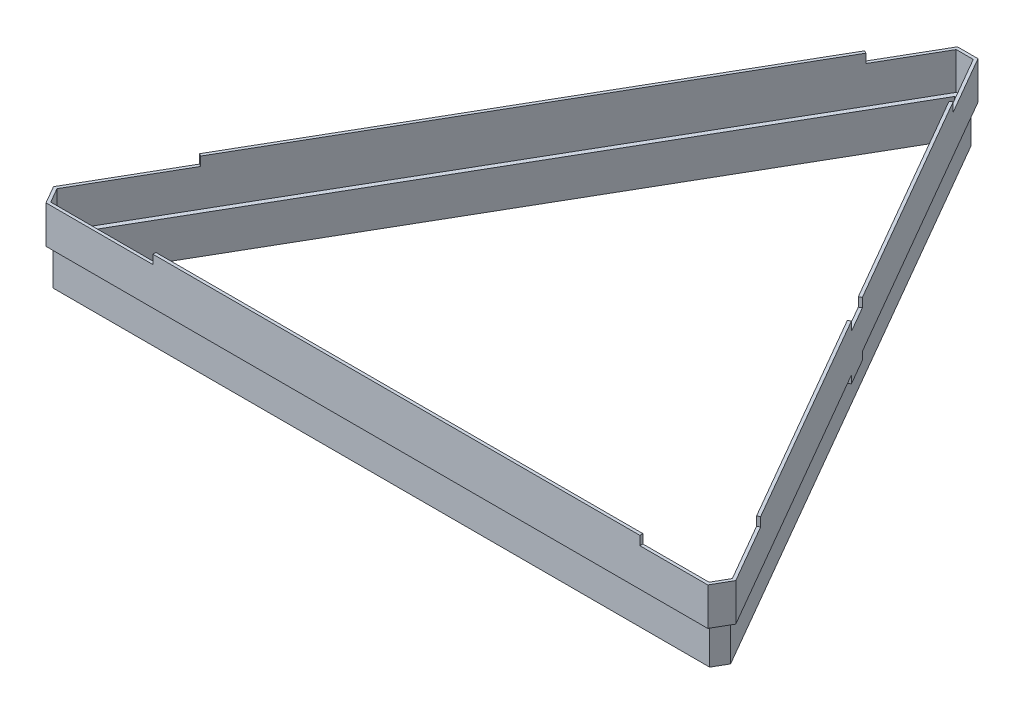
from build123d import *

# Parameters (mm, degrees)
BOSS_EXTRUDE1_DEPTH = 0.2
BOSS_EXTRUDE2_DEPTH = 12.58
SKETCH1_8_W         = 162.49
SKETCH1_8_H         = 1
BOSS_EXTRUDE3_DEPTH = 15.58
BOSS_EXTRUDE4_DEPTH = 12.38
BOSS_EXTRUDE5_DEPTH = 2.58


with BuildPart() as part:
    # Sketch1 → Boss-Extrude1 (new body)
    with BuildSketch(Plane(origin=(0, 0, 0), x_dir=(1, 0, 0), z_dir=(0, 1, 0))):
        Polygon((-113.845299462, 0), (-110.422649731, -5.92820323), (110.422649731, -5.92820323), (113.845299462, 0), (3.422649731, 191.25763964), (-3.422649731, 191.25763964), align=None)
        Polygon((108.979274058, -3.42820323), (-108.979274058, -3.42820323), (-110.958548116, 0), (-1.979274058, 188.75763964), (1.979274058, 188.75763964), (110.958548116, 0), align=None, mode=Mode.SUBTRACT)
    extrude(amount=BOSS_EXTRUDE1_DEPTH)

    # Sketch1<7> → Boss-Extrude2 (add)
    with BuildSketch(Plane(origin=(0, 0, 0), x_dir=(1, 0, 0), z_dir=(0, 1, 0))):
        Polygon((-95.137949192, 30.402081141), (-96.003974596, 30.902081141), (-113.845299462, 0), (-110.422649731, -5.92820323), (-74.74, -5.92820323), (-74.74, -4.92820323), (-109.845299462, -4.92820323), (-112.690598923, 0), align=None)
        Polygon((-3.422649731, 191.25763964), (-14.758974596, 171.622549002), (-13.892949192, 171.122549002), (-2.845299462, 190.25763964), (2.845299462, 190.25763964), (13.892949192, 171.122549002), (14.758974596, 171.622549002), (3.422649731, 191.25763964), align=None)
        Polygon((109.845299462, -4.92820323), (87.75, -4.92820323), (87.75, -5.92820323), (110.422649731, -5.92820323), (113.845299462, 0), (102.508974596, 19.635090638), (101.642949192, 19.135090638), (112.690598923, 0), align=None)
        Polygon((61.133974596, 91.298692801), (56.133974596, 99.958946839), (55.267949192, 99.458946839), (60.267949192, 90.798692801), align=None)
    extrude(amount=BOSS_EXTRUDE2_DEPTH)

    # Sketch1<8> → Boss-Extrude3 (add)
    with BuildSketch(Plane(origin=(0, 0, 0), x_dir=(1, 0, 0), z_dir=(0, 1, 0))):
        Polygon((-14.758974596, 171.622549002), (-96.003974596, 30.902081141), (-95.137949192, 30.402081141), (-13.892949192, 171.122549002), align=None)
        with Locations((6.505, -5.42820323)):
            Rectangle(SKETCH1_8_W, SKETCH1_8_H)
        Polygon((56.133974596, 99.958946839), (14.758974596, 171.622549002), (13.892949192, 171.122549002), (55.267949192, 99.458946839), align=None)
        Polygon((102.508974596, 19.635090638), (61.133974596, 91.298692801), (60.267949192, 90.798692801), (101.642949192, 19.135090638), align=None)
    extrude(amount=BOSS_EXTRUDE3_DEPTH)

    # Sketch1<9> → Boss-Extrude4 (add)
    with BuildSketch(Plane(origin=(0, 0, 0), x_dir=(1, 0, 0), z_dir=(0, 1, 0))):
        Polygon((-112.113248654, 0), (-110.834936491, -2.214101615), (-109.556624327, -4.42820323), (109.556624327, -4.42820323), (112.113248654, 0), (2.556624327, 189.75763964), (-2.556624327, 189.75763964), align=None)
        Polygon((-110.958548116, 0), (-56.468911087, 94.37881982), (-1.979274058, 188.75763964), (1.979274058, 188.75763964), (110.958548116, 0), (108.979274058, -3.42820323), (-108.979274058, -3.42820323), align=None, mode=Mode.SUBTRACT)
    extrude(amount=-BOSS_EXTRUDE4_DEPTH)

    # Sketch1<10> → Boss-Extrude5 (add)
    with BuildSketch(Plane(origin=(0, 0, 0), x_dir=(1, 0, 0), z_dir=(0, 1, 0))):
        Polygon((61.133974596, 91.298692801), (56.133974596, 99.958946839), (55.267949192, 99.458946839), (60.267949192, 90.798692801), align=None)
    extrude(amount=-BOSS_EXTRUDE5_DEPTH)


solid = part.part
